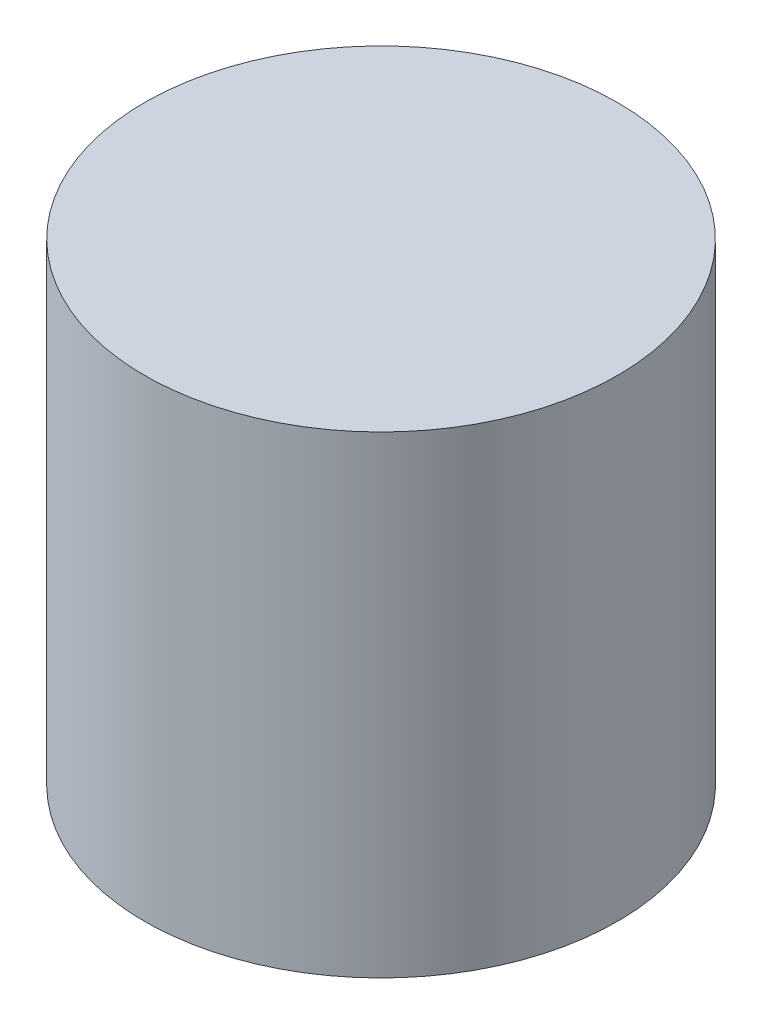
from build123d import *


with BuildPart() as part:
    # Sketch1 → Revolve1 (revolve)
    with BuildSketch(Plane(origin=(0, 0, 0), x_dir=(0, 0, -1), z_dir=(1, 0, 0))):
        Polygon((0, 158.549048986), (50, 158.549048986), (50, 108.549048986), (50, 58.549048986), (40, 58.549048986), (40, 138.549048986), (0, 138.549048986), align=None)
    revolve(axis=Axis((0, -3564.01431948, 0), (0, 1, 0)))


solid = part.part
